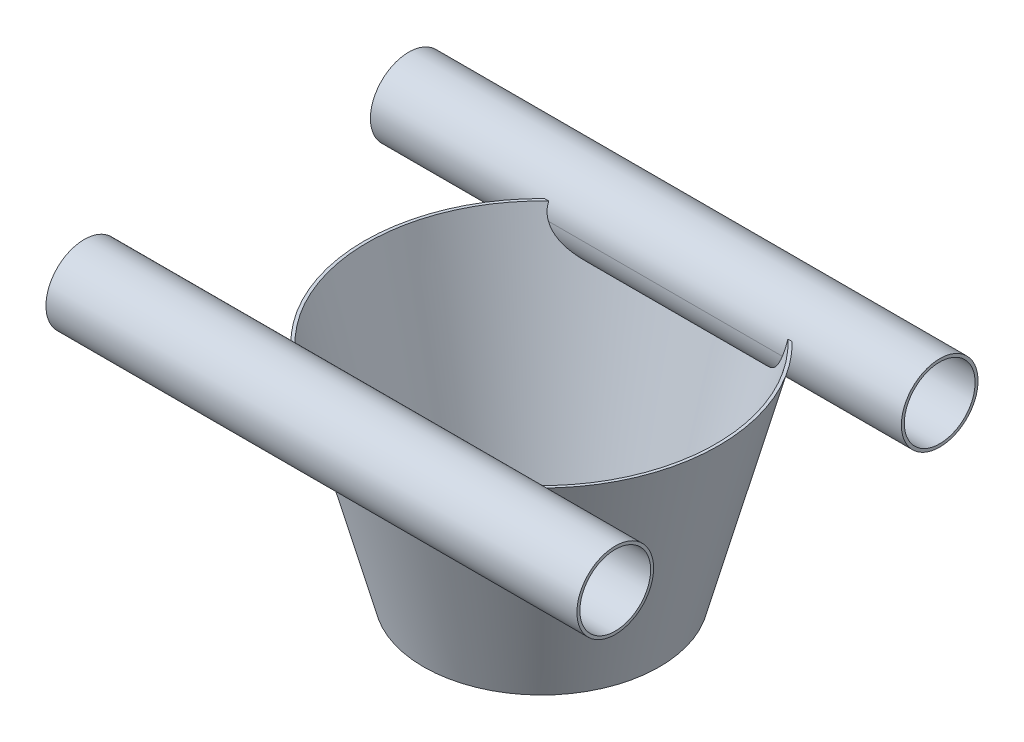
from build123d import *

# Parameters (mm, degrees)
SKETCH1_R                = 40
BOSS_EXTRUDE1_DEPTH      = 75
BOSS_EXTRUDE1_DRAFT      = -15
SKETCH2_R                = 39
CUT_EXTRUDE1_DEPTH       = 114.349477143
CUT_EXTRUDE1_DRAFT       = 15
CUT_EXTRUDE3_DEPTH       = 114.349477143
CUT_EXTRUDE3_DEPTH_BACK  = 114.349477143
SKETCH7_R                = 13
BOSS_EXTRUDE2_DEPTH      = 80
BOSS_EXTRUDE2_DEPTH_BACK = 100
SKETCH9_R                = 13
SKETCH9_R_2              = 12


with BuildPart() as part:
    # Sketch1 → Boss-Extrude1 (with draft: the straight prism first)
    with BuildSketch(Plane(origin=(0, 0, 0), x_dir=(1, 0, 0), z_dir=(0, 1, 0))):
        Circle(SKETCH1_R)
    extrude(amount=BOSS_EXTRUDE1_DEPTH)
    # Boss-Extrude1: the draft: its side faces are tilted about the plane it starts from
    boss_extrude1_sides = [part.faces().sort_by_distance(p)[0] for p in [
        (-40, 37.5, 0),
    ]]
    draft(boss_extrude1_sides, Plane(origin=(0, 0, 0), x_dir=(1, 0, 0), z_dir=(0, 1, 0)), BOSS_EXTRUDE1_DRAFT)


with BuildPart() as cut_extrude1_tool:
    # Sketch2 → Cut-Extrude1 (with draft: the straight prism first)
    with BuildSketch(Plane.XZ):
        Circle(SKETCH2_R)
    extrude(amount=-CUT_EXTRUDE1_DEPTH)
    # Cut-Extrude1: the draft: its side faces are tilted about the plane it starts from
    cut_extrude1_sides = [cut_extrude1_tool.faces().sort_by_distance(p)[0] for p in [
        (-39, 57.174738571, 0),
    ]]
    draft(cut_extrude1_sides, Plane.XZ, CUT_EXTRUDE1_DRAFT)


with BuildPart() as part_1:
    add(part.part)

    # Cut-Extrude1: cut by cut_extrude1_tool
    add(cut_extrude1_tool.part, mode=Mode.SUBTRACT)

    # Sketch7 → Cut-Extrude3 (cut, two sides: drawn at the far end of the back side and taken through both)
    with BuildSketch(Plane(origin=(0, 0, 0), x_dir=(0, 0, -1), z_dir=(1, 0, 0)).offset(-CUT_EXTRUDE3_DEPTH_BACK)):
        with Locations((-55, 70)):
            Circle(SKETCH7_R)
        with Locations((55, 70)):
            Circle(SKETCH7_R)
    extrude(amount=CUT_EXTRUDE3_DEPTH + CUT_EXTRUDE3_DEPTH_BACK, mode=Mode.SUBTRACT)

    # Sketch9 → Boss-Extrude2 (add, two sides: drawn at the far end of the back side and taken through both)
    # profile 1 of 2: a face of its own
    with BuildSketch(Plane(origin=(0, 0, 0), x_dir=(0, 0, -1), z_dir=(1, 0, 0)).offset(-BOSS_EXTRUDE2_DEPTH_BACK)):
        with Locations((-55, 70)):
            Circle(SKETCH9_R)
        with Locations((-55, 70)):
            Circle(SKETCH9_R_2, mode=Mode.SUBTRACT)
    # profile 2 of 2: a face of its own
    with BuildSketch(Plane(origin=(0, 0, 0), x_dir=(0, 0, -1), z_dir=(1, 0, 0)).offset(-BOSS_EXTRUDE2_DEPTH_BACK)):
        with Locations(Location((55, 70, 0), (0, 0, 180))):
            Circle(SKETCH9_R)
        with Locations(Location((55, 70, 0), (0, 0, 180))):
            Circle(SKETCH9_R_2, mode=Mode.SUBTRACT)
    extrude(amount=BOSS_EXTRUDE2_DEPTH + BOSS_EXTRUDE2_DEPTH_BACK)


solid = part_1.part
